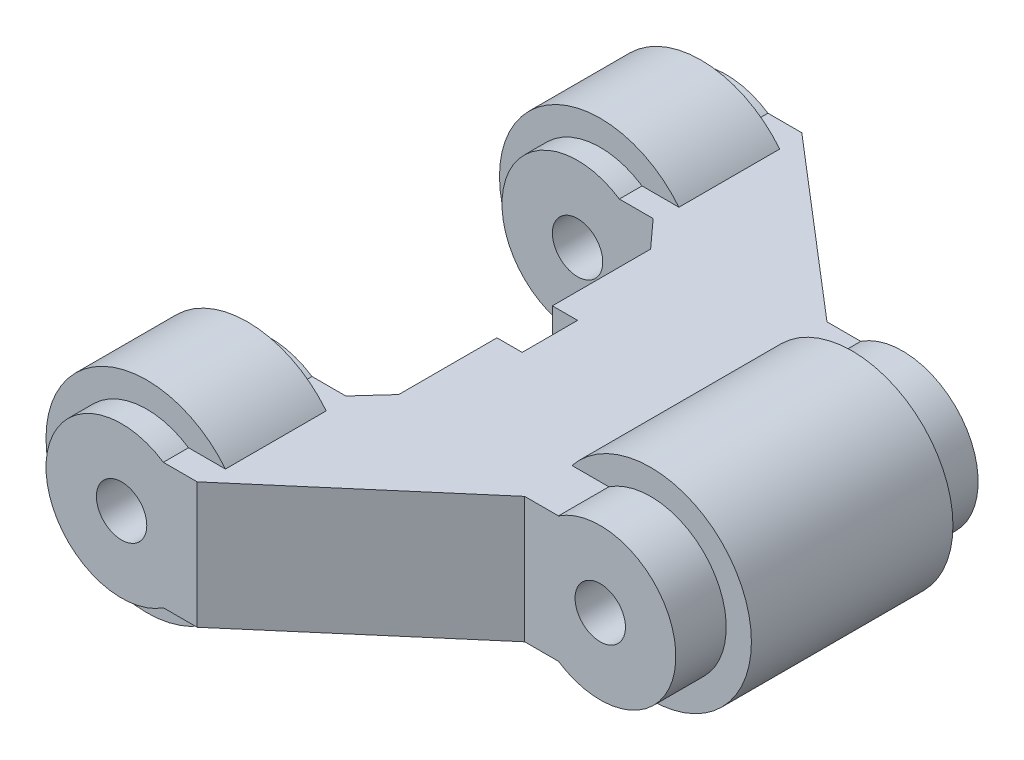
from build123d import *

# Parameters (mm, degrees)
SKETCH_1_R               = 3
SKETCH_1_R_2             = 1
EXTRUDE_1_DEPTH          = 6
SKETCH_1_4_R             = 4
SKETCH_1_4_R_2           = 3
EXTRUDE_2_DEPTH          = 4
SKETCH_1_5_R             = 3
SKETCH_1_5_R_2           = 1
EXTRUDE_3_DEPTH          = 12
SKETCH_2_R               = 4
SKETCH_2_R_2             = 3
EXTRUDE_4_DEPTH          = 2
CUT_EXTRUDE_1_DEPTH      = 17.439282223
CUT_EXTRUDE_1_DEPTH_BACK = 17.439282223
SKETCH_3_W               = 6
SKETCH_3_H               = 12.2
EXTRUDE_7_DEPTH          = 2.5
CUT_EXTRUDE_2_DEPTH      = 1.1


with BuildPart() as part:
    # Эскиз1 → Бобышка-Вытянуть1 (new, symmetric)
    with BuildSketch(Plane.XY):
        with Locations((6.5, 0)):
            Circle(SKETCH_1_R)
        with Locations((6.5, 0)):
            Circle(SKETCH_1_R_2, mode=Mode.SUBTRACT)
    extrude(amount=EXTRUDE_1_DEPTH, both=True)

    # Эскиз1<4> → Бобышка-Вытянуть2 (add, symmetric)
    with BuildSketch(Plane.XY):
        with Locations((6.5, 0)):
            Circle(SKETCH_1_4_R)
        with Locations((6.5, 0)):
            Circle(SKETCH_1_4_R_2, mode=Mode.SUBTRACT)
    extrude(amount=EXTRUDE_2_DEPTH, both=True)



with BuildPart() as body_2:
    # Эскиз1<5> → Бобышка-Вытянуть3 (new, symmetric)
    with BuildSketch(Plane.XY):
        with Locations((-6.5, 0)):
            Circle(SKETCH_1_5_R)
        with Locations((-6.5, 0)):
            Circle(SKETCH_1_5_R_2, mode=Mode.SUBTRACT)
    extrude(amount=EXTRUDE_3_DEPTH, both=True)

    # Эскиз2 → Бобышка-Вытянуть4 (add, symmetric)
    with BuildSketch(Plane.XY.offset(9)):
        with Locations((-6.5, 0)):
            Circle(SKETCH_2_R)
        with Locations((-6.5, 0)):
            Circle(SKETCH_2_R_2, mode=Mode.SUBTRACT)
    extrude_4 = extrude(amount=EXTRUDE_4_DEPTH, both=True)

    # Зеркальное отражение1: Бобышка-Вытянуть4 across plane
    add(extrude_4.mirror(Plane.XY))

    # Эскиз3 → Вырез-Вытянуть1 (cut, two sides: drawn at the far end of the back side and taken through both)
    with BuildSketch(Plane(origin=(0, 0, 0), x_dir=(1, 0, 0), z_dir=(0, 1, 0)).offset(-CUT_EXTRUDE_1_DEPTH_BACK)):
        with Locations((-6.5, 0)):
            Rectangle(SKETCH_3_W, SKETCH_3_H)
    extrude(amount=CUT_EXTRUDE_1_DEPTH + CUT_EXTRUDE_1_DEPTH_BACK, mode=Mode.SUBTRACT)


with BuildPart() as cut_extrude_1_piece_1:
    # of the separate pieces the step leaves, piece 1, a body of its own (cut_extrude_1_pieces)
    add(body_2.part.solids().sort_by_distance((-3.5, 0, -12))[0])


with BuildPart() as cut_extrude_1_piece_2:
    # of the separate pieces the step leaves, piece 2, a body of its own (cut_extrude_1_pieces)
    add(body_2.part.solids().sort_by_distance((-5.5, 0, 12))[0])


with BuildPart() as part_1:
    add(part.part)

    add(cut_extrude_1_piece_1.part)  # Бобышка-Вытянуть7 merges Вырез-Вытянуть1 piece 1

    add(cut_extrude_1_piece_2.part)  # Бобышка-Вытянуть7 merges Вырез-Вытянуть1 piece 2
    # Эскиз4 → Бобышка-Вытянуть7 (add, symmetric)
    with BuildSketch(Plane(origin=(0, 0, 0), x_dir=(1, 0, 0), z_dir=(0, 1, 0))):
        Polygon((5.5, -6), (5.5, 6), (3.5, 6), (-3.5, 12), (-5.5, 12), (-5.5, 6.1), (-3.5, 6.1), (-2.5, 5), (-2.5, -5), (-3.5, -6.1), (-5.5, -6.1), (-5.5, -12), (-3.5, -12), (3.5, -6), align=None)
    extrude(amount=EXTRUDE_7_DEPTH, both=True)

    # Эскиз5 → Вырез-Вытянуть2 (cut, symmetric)
    with BuildSketch(Plane.XY):
        Polygon((-2.5, 2.5), (-2.5, -2.5), (-1.5, 2.5), align=None)
    extrude(amount=CUT_EXTRUDE_2_DEPTH, both=True, mode=Mode.SUBTRACT)


solid = part_1.part
